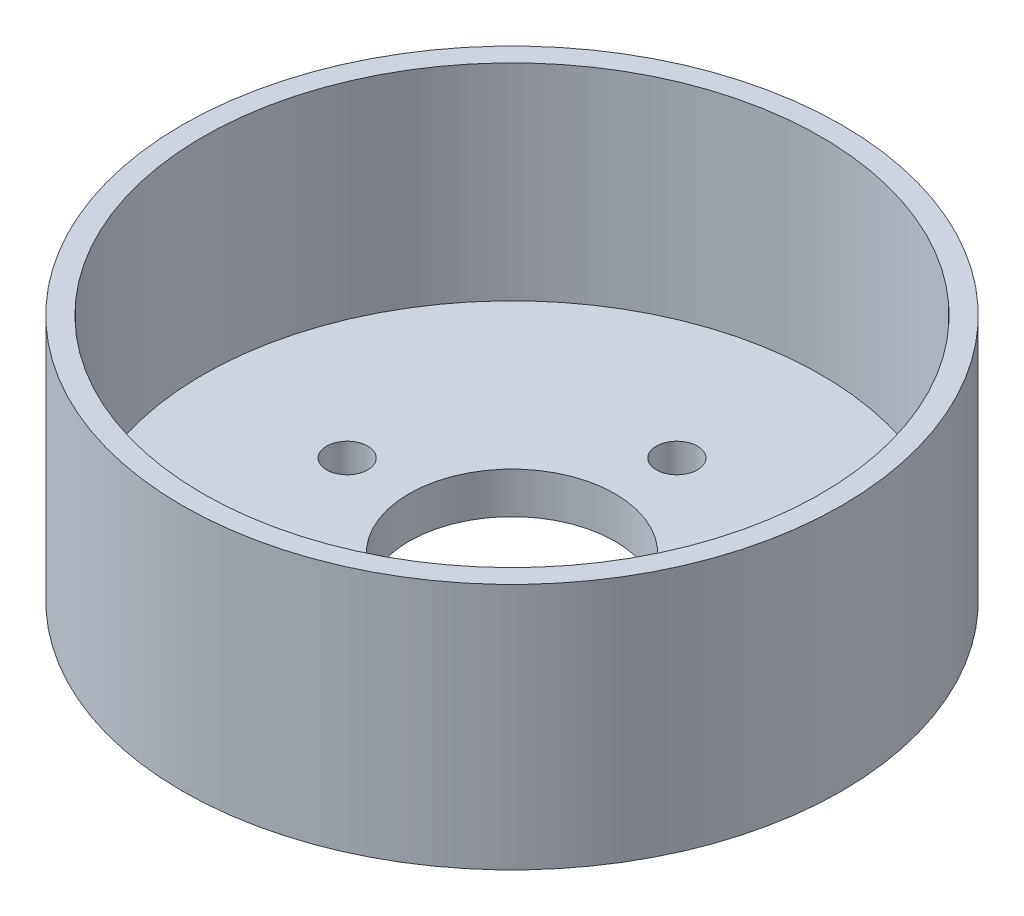
from build123d import *

# Parameters (mm, degrees)
SKETCH1_R           = 16
BOSS_EXTRUDE1_DEPTH = 12.5
SKETCH2_R           = 15
CUT_EXTRUDE1_DEPTH  = 10
SKETCH3_R           = 5
CUT_EXTRUDE2_DEPTH  = 10
SKETCH4_R           = 1
CUT_EXTRUDE3_DEPTH  = 10
SKETCH5_R           = 16
CUT_EXTRUDE4_DEPTH  = 0.5


with BuildPart() as part:
    # Sketch1 → Boss-Extrude1 (new body)
    with BuildSketch(Plane(origin=(0, 0, 0), x_dir=(1, 0, 0), z_dir=(0, 1, 0))):
        with Locations(Location((0, 0, 0), (0, 0, 270))):
            Circle(SKETCH1_R)
    extrude(amount=BOSS_EXTRUDE1_DEPTH)

    # Sketch2 → Cut-Extrude1 (cut)
    with BuildSketch(Plane(origin=(0, 12.5, 0), x_dir=(1, 0, 0), z_dir=(0, 1, 0))):
        with Locations(Location((0, 0, 0), (0, 0, 270))):
            Circle(SKETCH2_R)
    extrude(amount=-CUT_EXTRUDE1_DEPTH, mode=Mode.SUBTRACT)

    # Sketch3 → Cut-Extrude2 (cut)
    with BuildSketch(Plane(origin=(0, 0, 0), x_dir=(-1, 0, 0), z_dir=(0, -1, 0))):
        with Locations(Location((0, 0, 0), (0, 0, 90))):
            Circle(SKETCH3_R)
    extrude(amount=-CUT_EXTRUDE2_DEPTH, mode=Mode.SUBTRACT)

    # Sketch4 → Cut-Extrude3 (cut)
    with BuildSketch(Plane(origin=(0, 0, 0), x_dir=(-1, 0, 0), z_dir=(0, -1, 0))):
        with Locations(Location((0, 8, 0), (0, 0, 90))):
            Circle(SKETCH4_R)
        with Locations(Location((0, -8, 0), (0, 0, 90))):
            Circle(SKETCH4_R)
        with Locations(Location((-8, 0, 0), (0, 0, 90))):
            Circle(SKETCH4_R)
        with Locations(Location((8, 0, 0), (0, 0, 90))):
            Circle(SKETCH4_R)
    extrude(amount=-CUT_EXTRUDE3_DEPTH, mode=Mode.SUBTRACT)

    # Sketch5 → Cut-Extrude4 (cut)
    with BuildSketch(Plane.XZ):
        with Locations(Location((0, 0, 0), (0, 0, 270))):
            Circle(SKETCH5_R)
    extrude(amount=-CUT_EXTRUDE4_DEPTH, mode=Mode.SUBTRACT)


solid = part.part
